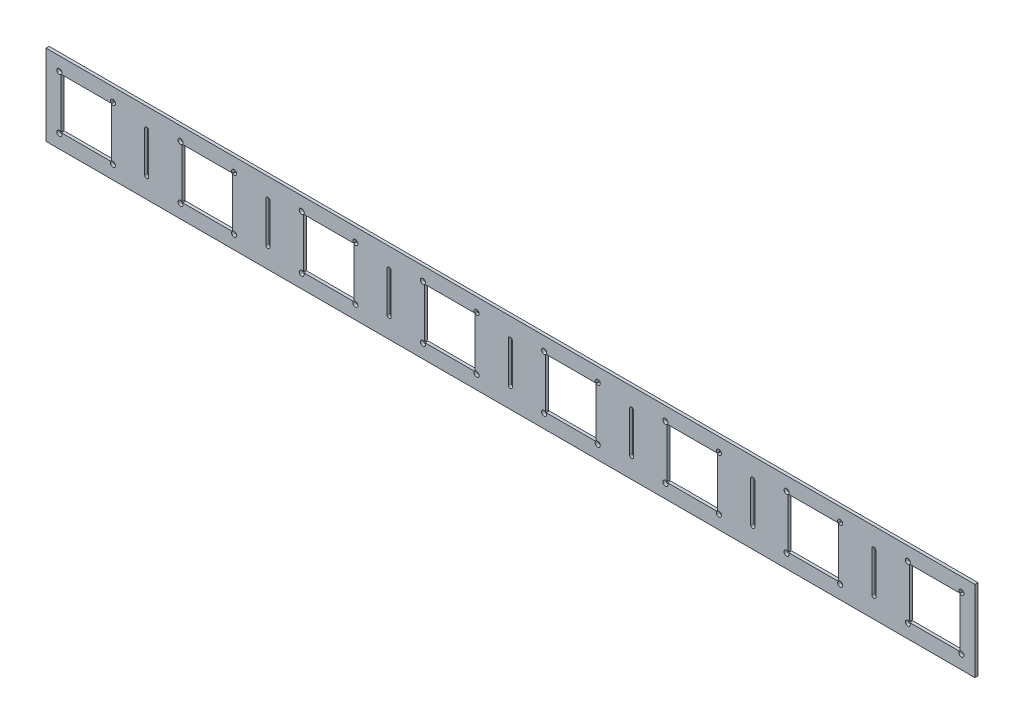
from build123d import *

# Parameters (mm, degrees)
SKETCH_1_W          = 919.725090766
SKETCH_1_H          = 80
EXTRUDE_1_DEPTH     = 3
CUT_EXTRUDE_1_DEPTH = 3


with BuildPart() as part:
    # Эскиз1 → Бобышка-Вытянуть1 (new body)
    with BuildSketch(Plane.XY):
        with Locations((-419.862545383, 0)):
            Rectangle(SKETCH_1_W, SKETCH_1_H)
        with BuildLine():
            Line((-815.471010416, -25), (-864.528989584, -25))
            ThreePointArc((-864.528989584, -25), (-864.148088497, -25.716125252), (-864.016504294, -26.516504295))
            ThreePointArc((-864.016504294, -26.516504295), (-868.757180614, -27.625273717), (-865, -24.528989584))
            Line((-865, -24.528989584), (-865, 24.528989584))
            ThreePointArc((-865, 24.528989584), (-868.757180614, 27.625273717), (-864.016504295, 26.516504294))
            ThreePointArc((-864.016504295, 26.516504294), (-864.148088497, 25.716125252), (-864.528989584, 25))
            Line((-864.528989584, 25), (-815.471010416, 25))
            ThreePointArc((-815.471010416, 25), (-814.283874748, 28.884920092), (-810.983495706, 26.516504294))
            ThreePointArc((-810.983495706, 26.516504294), (-812.374726283, 24.275827975), (-815, 24.528989584))
            Line((-815, 24.528989584), (-815, -24.528989584))
            ThreePointArc((-815, -24.528989584), (-812.374726283, -24.275827975), (-810.983495705, -26.516504294))
            ThreePointArc((-810.983495705, -26.516504294), (-814.283874748, -28.884920092), (-815.471010416, -25))
        make_face(mode=Mode.SUBTRACT)
        with BuildLine():
            Line((-695.471010416, -25), (-744.528989584, -25))
            ThreePointArc((-744.528989584, -25), (-744.148088497, -25.716125252), (-744.016504294, -26.516504295))
            ThreePointArc((-744.016504294, -26.516504295), (-748.757180614, -27.625273717), (-745, -24.528989584))
            Line((-745, -24.528989584), (-745, 24.528989584))
            ThreePointArc((-745, 24.528989584), (-748.757180614, 27.625273717), (-744.016504295, 26.516504294))
            ThreePointArc((-744.016504295, 26.516504294), (-744.148088497, 25.716125252), (-744.528989584, 25))
            Line((-744.528989584, 25), (-695.471010416, 25))
            ThreePointArc((-695.471010416, 25), (-694.283874748, 28.884920092), (-690.983495706, 26.516504295))
            ThreePointArc((-690.983495706, 26.516504295), (-692.374726283, 24.275827975), (-695, 24.528989584))
            Line((-695, 24.528989584), (-695, -24.528989584))
            ThreePointArc((-695, -24.528989584), (-692.374726283, -24.275827975), (-690.983495705, -26.516504294))
            ThreePointArc((-690.983495705, -26.516504294), (-694.283874748, -28.884920092), (-695.471010416, -25))
        make_face(mode=Mode.SUBTRACT)
        with BuildLine():
            Line((-575.471010416, -25), (-624.528989584, -25))
            ThreePointArc((-624.528989584, -25), (-624.148088497, -25.716125252), (-624.016504294, -26.516504295))
            ThreePointArc((-624.016504294, -26.516504295), (-628.757180614, -27.625273717), (-625, -24.528989584))
            Line((-625, -24.528989584), (-625, 24.528989584))
            ThreePointArc((-625, 24.528989584), (-628.757180614, 27.625273717), (-624.016504295, 26.516504294))
            ThreePointArc((-624.016504295, 26.516504294), (-624.148088497, 25.716125252), (-624.528989584, 25))
            Line((-624.528989584, 25), (-575.471010416, 25))
            ThreePointArc((-575.471010416, 25), (-574.283874748, 28.884920092), (-570.983495706, 26.516504295))
            ThreePointArc((-570.983495706, 26.516504295), (-572.374726283, 24.275827975), (-575, 24.528989584))
            Line((-575, 24.528989584), (-575, -24.528989584))
            ThreePointArc((-575, -24.528989584), (-572.374726283, -24.275827975), (-570.983495705, -26.516504294))
            ThreePointArc((-570.983495705, -26.516504294), (-574.283874748, -28.884920092), (-575.471010416, -25))
        make_face(mode=Mode.SUBTRACT)
        with BuildLine():
            Line((-455.471010416, -25), (-504.528989584, -25))
            ThreePointArc((-504.528989584, -25), (-504.148088497, -25.716125252), (-504.016504294, -26.516504295))
            ThreePointArc((-504.016504294, -26.516504295), (-508.757180614, -27.625273717), (-505, -24.528989584))
            Line((-505, -24.528989584), (-505, 24.528989584))
            ThreePointArc((-505, 24.528989584), (-508.757180614, 27.625273717), (-504.016504295, 26.516504294))
            ThreePointArc((-504.016504295, 26.516504294), (-504.148088497, 25.716125252), (-504.528989584, 25))
            Line((-504.528989584, 25), (-455.471010416, 25))
            ThreePointArc((-455.471010416, 25), (-454.283874748, 28.884920092), (-450.983495706, 26.516504295))
            ThreePointArc((-450.983495706, 26.516504295), (-452.374726283, 24.275827975), (-455, 24.528989584))
            Line((-455, 24.528989584), (-455, -24.528989584))
            ThreePointArc((-455, -24.528989584), (-452.374726283, -24.275827975), (-450.983495705, -26.516504294))
            ThreePointArc((-450.983495705, -26.516504294), (-454.283874748, -28.884920092), (-455.471010416, -25))
        make_face(mode=Mode.SUBTRACT)
        with BuildLine():
            Line((-335.471010416, -25), (-384.528989584, -25))
            ThreePointArc((-384.528989584, -25), (-384.148088497, -25.716125252), (-384.016504294, -26.516504295))
            ThreePointArc((-384.016504294, -26.516504295), (-388.757180614, -27.625273717), (-385, -24.528989584))
            Line((-385, -24.528989584), (-385, 24.528989584))
            ThreePointArc((-385, 24.528989584), (-388.757180614, 27.625273717), (-384.016504295, 26.516504294))
            ThreePointArc((-384.016504295, 26.516504294), (-384.148088497, 25.716125252), (-384.528989584, 25))
            Line((-384.528989584, 25), (-335.471010416, 25))
            ThreePointArc((-335.471010416, 25), (-334.283874748, 28.884920092), (-330.983495706, 26.516504295))
            ThreePointArc((-330.983495706, 26.516504295), (-332.374726283, 24.275827975), (-335, 24.528989584))
            Line((-335, 24.528989584), (-335, -24.528989584))
            ThreePointArc((-335, -24.528989584), (-332.374726283, -24.275827975), (-330.983495705, -26.516504294))
            ThreePointArc((-330.983495705, -26.516504294), (-334.283874748, -28.884920092), (-335.471010416, -25))
        make_face(mode=Mode.SUBTRACT)
        with BuildLine():
            Line((-215.471010416, -25), (-264.528989584, -25))
            ThreePointArc((-264.528989584, -25), (-264.148088497, -25.716125252), (-264.016504294, -26.516504295))
            ThreePointArc((-264.016504294, -26.516504295), (-268.757180614, -27.625273717), (-265, -24.528989584))
            Line((-265, -24.528989584), (-265, 24.528989584))
            ThreePointArc((-265, 24.528989584), (-268.757180614, 27.625273717), (-264.016504295, 26.516504294))
            ThreePointArc((-264.016504295, 26.516504294), (-264.148088497, 25.716125252), (-264.528989584, 25))
            Line((-264.528989584, 25), (-215.471010416, 25))
            ThreePointArc((-215.471010416, 25), (-214.283874748, 28.884920092), (-210.983495706, 26.516504295))
            ThreePointArc((-210.983495706, 26.516504295), (-212.374726283, 24.275827975), (-215, 24.528989584))
            Line((-215, 24.528989584), (-215, -24.528989584))
            ThreePointArc((-215, -24.528989584), (-212.374726283, -24.275827975), (-210.983495705, -26.516504294))
            ThreePointArc((-210.983495705, -26.516504294), (-214.283874748, -28.884920092), (-215.471010416, -25))
        make_face(mode=Mode.SUBTRACT)
        with BuildLine():
            Line((-95.471010416, -25), (-144.528989584, -25))
            ThreePointArc((-144.528989584, -25), (-144.148088497, -25.716125252), (-144.016504294, -26.516504295))
            ThreePointArc((-144.016504294, -26.516504295), (-148.757180614, -27.625273717), (-145, -24.528989584))
            Line((-145, -24.528989584), (-145, 24.528989584))
            ThreePointArc((-145, 24.528989584), (-148.757180614, 27.625273717), (-144.016504295, 26.516504294))
            ThreePointArc((-144.016504295, 26.516504294), (-144.148088497, 25.716125252), (-144.528989584, 25))
            Line((-144.528989584, 25), (-95.471010416, 25))
            ThreePointArc((-95.471010416, 25), (-94.283874748, 28.884920092), (-90.983495706, 26.516504295))
            ThreePointArc((-90.983495706, 26.516504295), (-92.374726283, 24.275827975), (-95, 24.528989584))
            Line((-95, 24.528989584), (-95, -24.528989584))
            ThreePointArc((-95, -24.528989584), (-92.374726283, -24.275827975), (-90.983495705, -26.516504294))
            ThreePointArc((-90.983495705, -26.516504294), (-94.283874748, -28.884920092), (-95.471010416, -25))
        make_face(mode=Mode.SUBTRACT)
        with BuildLine():
            Line((24.528989584, -25), (-24.528989584, -25))
            ThreePointArc((-24.528989584, -25), (-24.148088497, -25.716125252), (-24.016504294, -26.516504295))
            ThreePointArc((-24.016504294, -26.516504295), (-28.757180614, -27.625273717), (-25, -24.528989584))
            Line((-25, -24.528989584), (-25, 24.528989584))
            ThreePointArc((-25, 24.528989584), (-28.757180614, 27.625273717), (-24.016504295, 26.516504294))
            ThreePointArc((-24.016504295, 26.516504294), (-24.148088497, 25.716125252), (-24.528989584, 25))
            Line((-24.528989584, 25), (24.528989584, 25))
            ThreePointArc((24.528989584, 25), (25.716125252, 28.884920092), (29.016504294, 26.516504295))
            ThreePointArc((29.016504294, 26.516504295), (27.625273717, 24.275827975), (25, 24.528989584))
            Line((25, 24.528989584), (25, -24.528989584))
            ThreePointArc((25, -24.528989584), (27.625273717, -24.275827975), (29.016504295, -26.516504294))
            ThreePointArc((29.016504295, -26.516504294), (25.716125252, -28.884920092), (24.528989584, -25))
        make_face(mode=Mode.SUBTRACT)
    extrude(amount=EXTRUDE_1_DEPTH)

    # Эскиз2 → Вырез-Вытянуть1 (cut)
    with BuildSketch(Plane(origin=(0, 0, 0), x_dir=(-1, 0, 0), z_dir=(0, 0, -1))):
        with BuildLine():
            Line((62, 20), (62, -20))
            ThreePointArc((62, -20), (60, -22), (58, -20))
            Line((58, -20), (58, 20))
            ThreePointArc((58, 20), (60, 22), (62, 20))
        make_face()
        with BuildLine():
            Line((182, 20), (182, -20))
            ThreePointArc((182, -20), (180, -22), (178, -20))
            Line((178, -20), (178, 20))
            ThreePointArc((178, 20), (180, 22), (182, 20))
        make_face()
        with BuildLine():
            Line((302, 20), (302, -20))
            ThreePointArc((302, -20), (300, -22), (298, -20))
            Line((298, -20), (298, 20))
            ThreePointArc((298, 20), (300, 22), (302, 20))
        make_face()
        with BuildLine():
            Line((422, 20), (422, -20))
            ThreePointArc((422, -20), (420, -22), (418, -20))
            Line((418, -20), (418, 20))
            ThreePointArc((418, 20), (420, 22), (422, 20))
        make_face()
        with BuildLine():
            Line((542, 20), (542, -20))
            ThreePointArc((542, -20), (540, -22), (538, -20))
            Line((538, -20), (538, 20))
            ThreePointArc((538, 20), (540, 22), (542, 20))
        make_face()
        with BuildLine():
            Line((662, 20), (662, -20))
            ThreePointArc((662, -20), (660, -22), (658, -20))
            Line((658, -20), (658, 20))
            ThreePointArc((658, 20), (660, 22), (662, 20))
        make_face()
        with BuildLine():
            Line((782, 20), (782, -20))
            ThreePointArc((782, -20), (780, -22), (778, -20))
            Line((778, -20), (778, 20))
            ThreePointArc((778, 20), (780, 22), (782, 20))
        make_face()
    extrude(amount=-CUT_EXTRUDE_1_DEPTH, mode=Mode.SUBTRACT)


solid = part.part
